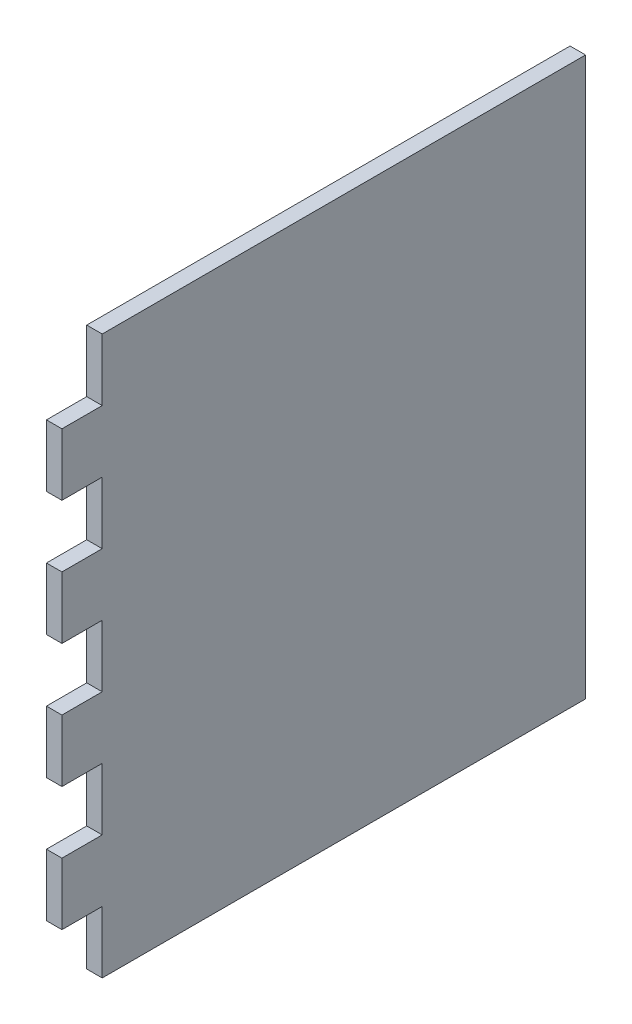
from build123d import *

# Parameters (mm, degrees)
BOSS_EXTRUDE1_DEPTH = 6.35


with BuildPart() as part:
    # Sketch2 → Boss-Extrude1 (new body)
    with BuildSketch(Plane(origin=(0, 0, 0), x_dir=(0, 0, -1), z_dir=(1, 0, 0))):
        Polygon((-115.57, 38.1), (-115.57, 12.7), (-99.06, 12.7), (-99.06, -12.7), (-115.57, -12.7), (-115.57, -38.1), (-99.06, -38.1), (-99.06, -63.5), (-115.57, -63.5), (-115.57, -88.9), (-99.06, -88.9), (-99.06, -114.3), (99.06, -114.3), (99.06, 114.3), (-99.06, 114.3), (-99.06, 88.9), (-115.57, 88.9), (-115.57, 63.5), (-99.06, 63.5), (-99.06, 38.1), align=None)
    extrude(amount=BOSS_EXTRUDE1_DEPTH)


solid = part.part
